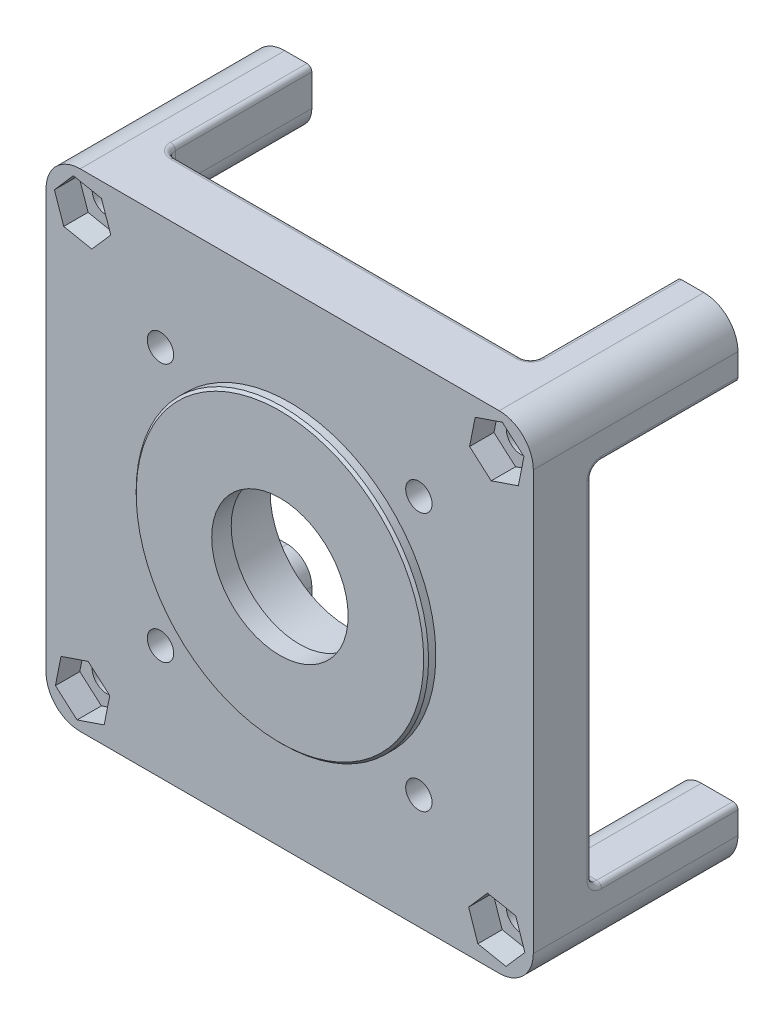
from build123d import *

# Parameters (mm, degrees)
SKETCH2_W                  = 100
SKETCH2_H                  = 100
BOSS_EXTRUDE1_DEPTH        = 12
SKETCH3_R                  = 16
CUT_EXTRUDE1_DEPTH         = 10
M6_CLEARANCE_HOLE1_D       = 6.1
BOSS_EXTRUDE2_START        = 30
SKETCH17_R                 = 3.05
BOSS_EXTRUDE2_DEPTH        = 30
CIRPATTERN1_COUNT          = 4
SKETCH18_R                 = 14
CUT_EXTRUDE3_DEPTH         = 77.811457479
FILLET1_R                  = 2
FILLET2_R                  = 7
CUT_EXTRUDE6_DEPTH         = 5
CIRPATTERN2_COUNT          = 4
SKETCH25_R                 = 30
SKETCH25_R_2               = 14
BOSS_EXTRUDE3_DEPTH        = 2
F_3_0_213_DIAMETER_HOLE1_D = 5.4102
CHAMFER1_SIZE              = 0.5
FILLET3_R                  = 1


with BuildPart() as part:
    # Sketch2 → Boss-Extrude1 (new body)
    with BuildSketch(Plane.XY):
        Rectangle(SKETCH2_W, SKETCH2_H)
    extrude(amount=BOSS_EXTRUDE1_DEPTH)

    # Sketch3 → Cut-Extrude1 (cut)
    with BuildSketch(Plane(origin=(0, 0, 0), x_dir=(-1, 0, 0), z_dir=(0, 0, -1))):
        Circle(SKETCH3_R)
    extrude(amount=-CUT_EXTRUDE1_DEPTH, mode=Mode.SUBTRACT)

    # M6 Clearance Hole1 (through all)
    with Locations(Plane(origin=(0, 0, 12), x_dir=(-1, 0, 0), z_dir=(0, 0, 1))):
        with Locations((42.5, -42.5), (-42.5, 42.5), (-42.5, -42.5), (42.5, 42.5)):
            Hole(M6_CLEARANCE_HOLE1_D / 2)

    # Sketch17 → Boss-Extrude2 (add)
    with BuildSketch(Plane(origin=(0, 0, 0), x_dir=(-1, 0, 0), z_dir=(0, 0, -1)).offset(BOSS_EXTRUDE2_START)):
        with BuildLine():
            Line((-37.45, 42.5), (-37.45, 50))
            Line((-37.45, 50), (-50, 50))
            Line((-50, 50), (-50, 37.45))
            Line((-50, 37.45), (-42.5, 37.45))
            ThreePointArc((-42.5, 37.45), (-38.929110755, 38.929110755), (-37.45, 42.5))
        make_face()
        with Locations(Location((-42.5, 42.5, 0), (0, 0, 180))):
            Circle(SKETCH17_R, mode=Mode.SUBTRACT)
    boss_extrude2 = extrude(amount=-BOSS_EXTRUDE2_DEPTH)

    # CirPattern1: Boss-Extrude2 ×4 about axis
    cirpattern1_axis = Axis((0, 0, 0), (0, 0, 1))
    for i in range(1, CIRPATTERN1_COUNT):
        add(boss_extrude2.rotate(cirpattern1_axis, i * 360 / CIRPATTERN1_COUNT))

    # Sketch18 → Cut-Extrude3 (cut, through all)
    with BuildSketch(Plane(origin=(0, 0, 0), x_dir=(-1, 0, 0), z_dir=(0, 0, -1))):
        Circle(SKETCH18_R)
    extrude(amount=-CUT_EXTRUDE3_DEPTH, mode=Mode.SUBTRACT)

    # Fillet1
    fillet1_edges = [part.edges().sort_by_distance(p)[0] for p in [
        (38.929110755, 38.929110755, 0),
        (37.45, 46.25, 0),
        (46.25, 37.45, 0),
        (-38.929110755, 38.929110755, 0),
        (-46.25, 37.45, 0),
        (-37.45, 46.25, 0),
        (-38.929110755, -38.929110755, 0),
        (-37.45, -46.25, 0),
        (-46.25, -37.45, 0),
        (38.929110755, -38.929110755, 0),
        (46.25, -37.45, 0),
        (37.45, -46.25, 0),
    ]]
    fillet(fillet1_edges, radius=FILLET1_R)

    # Fillet2
    fillet2_edges = [part.edges().sort_by_distance(p)[0] for p in [
        (50, -50, -9),
        (-50, -50, -9),
        (-50, 50, -9),
        (50, 50, -9),
    ]]
    fillet(fillet2_edges, radius=FILLET2_R)

    # Sketch24 → Cut-Extrude6 (cut)
    with BuildSketch(Plane.XY.offset(12)):
        Polygon((-44.400625379, 48.073833795), (-48.277394352, 43.640927036), (-46.376768973, 38.067093242), (-40.599374621, 36.926166205), (-36.722605648, 41.359072964), (-38.623231027, 46.932906758), align=None)
    cut_extrude6 = extrude(amount=-CUT_EXTRUDE6_DEPTH, mode=Mode.SUBTRACT)

    # CirPattern2: Cut-Extrude6 ×4 about axis
    cirpattern2_axis = Axis((0, 0, 0), (0, 0, 1))
    for i in range(1, CIRPATTERN2_COUNT):
        add(cut_extrude6.rotate(cirpattern2_axis, i * 360 / CIRPATTERN2_COUNT), mode=Mode.SUBTRACT)

    # Sketch25 → Boss-Extrude3 (add)
    with BuildSketch(Plane.XY.offset(12)):
        with Locations(Location((0, 0, 0), (0, 0, 180))):
            Circle(SKETCH25_R)
        with Locations(Location((0, 0, 0), (0, 0, 180))):
            Circle(SKETCH25_R_2, mode=Mode.SUBTRACT)
    extrude(amount=BOSS_EXTRUDE3_DEPTH)

    # #3 (0.213) Diameter Hole1 (through all)
    with Locations(Plane(origin=(26.516504294, 26.516504294, 12), x_dir=(1, 0, 0), z_dir=(0, 0, 1))):
        with Locations((0, 0), (-53.033008588, 0), (-53.033008588, -53.033008588), (0, -53.033008588)):
            Hole(F_3_0_213_DIAMETER_HOLE1_D / 2)

    # Chamfer1
    chamfer1_edges = [part.edges().sort_by_distance(p)[0] for p in [
        (30, 0, 14),
    ]]
    chamfer(chamfer1_edges, length=CHAMFER1_SIZE)

    # Fillet3
    fillet3_edges = [part.edges().sort_by_distance(p)[0] for p in [
        (50, 0, 0),
        (0, -50, 0),
        (-50, 0, 0),
        (0, 50, 0),
        (-36.864213562, 50, -0.585786438),
        (-50, 36.864213562, -0.585786438),
        (-50, -36.864213562, -0.585786438),
        (-36.864213562, -50, -0.585786438),
        (36.864213562, -50, -0.585786438),
        (50, -36.864213562, -0.585786438),
        (50, 36.864213562, -0.585786438),
        (36.864213562, 50, -0.585786438),
        (37.45, 50, -16),
        (50, 37.45, -16),
        (-50, 37.45, -16),
        (-37.45, 50, -16),
        (-37.45, -50, -16),
        (-50, -37.45, -16),
        (50, -37.45, -16),
        (37.45, -50, -16),
    ]]
    fillet(fillet3_edges, radius=FILLET3_R)


solid = part.part
